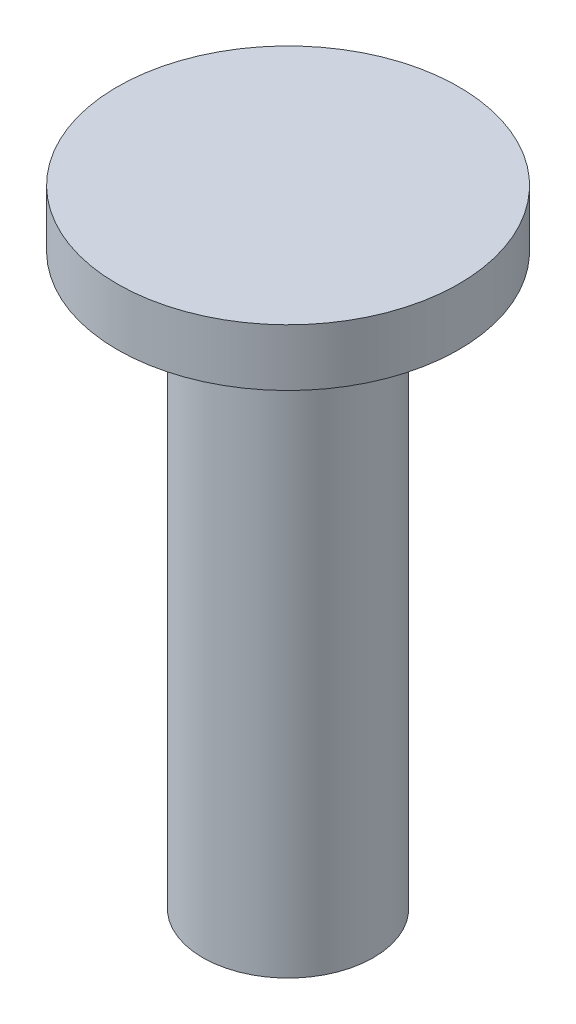
from build123d import *

# Parameters (mm, degrees)
SKETCH_1_R      = 3
EXTRUDE_1_DEPTH = 1
SKETCH_2_R      = 1.5
EXTRUDE_2_DEPTH = 10


with BuildPart() as part:
    # 草图1 → 凸台-拉伸1 (new body)
    with BuildSketch(Plane(origin=(0, 0, 0), x_dir=(1, 0, 0), z_dir=(0, 1, 0))):
        with Locations(Location((0, 0, 0), (0, 0, 270))):
            Circle(SKETCH_1_R)
    extrude(amount=EXTRUDE_1_DEPTH)

    # 草图2 → 凸台-拉伸2 (add)
    with BuildSketch(Plane.XZ):
        with Locations(Location((0, 0, 0), (0, 0, 270))):
            Circle(SKETCH_2_R)
    extrude(amount=EXTRUDE_2_DEPTH)


solid = part.part
